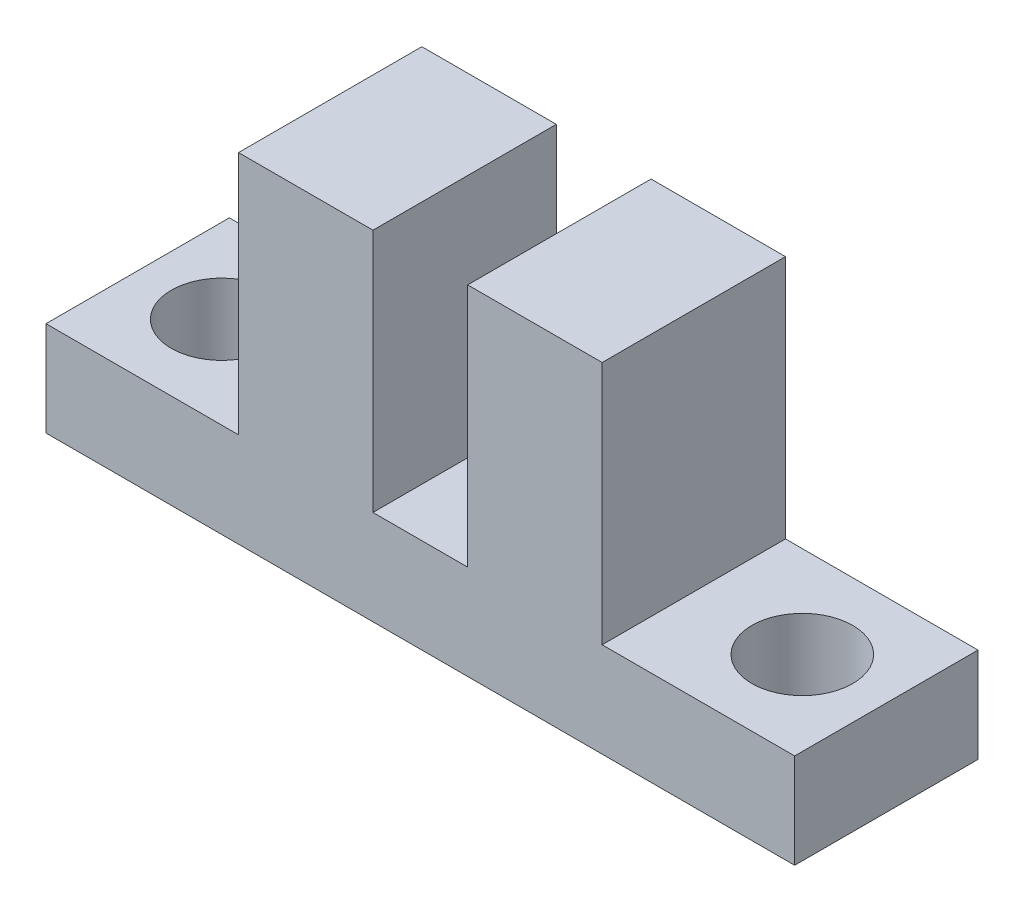
from build123d import *

# Parameters (mm, degrees)
SKETCH1_W           = 24.5
SKETCH1_H           = 6
SKETCH1_R           = 1.65
BOSS_EXTRUDE1_DEPTH = 3.1
SKETCH2_W           = 4.4
SKETCH2_H           = 6
BOSS_EXTRUDE2_DEPTH = 8


with BuildPart() as part:
    # Sketch1 → Boss-Extrude1 (new body)
    with BuildSketch(Plane(origin=(0, 0, 0), x_dir=(1, 0, 0), z_dir=(0, 1, 0))):
        with Locations((12.25, 3)):
            Rectangle(SKETCH1_W, SKETCH1_H)
        with Locations(Location((2.75, 3, 0), (0, 0, 90))):
            Circle(SKETCH1_R, mode=Mode.SUBTRACT)
        with Locations(Location((21.75, 3, 0), (0, 0, 90))):
            Circle(SKETCH1_R, mode=Mode.SUBTRACT)
    extrude(amount=BOSS_EXTRUDE1_DEPTH)

    # Sketch2 → Boss-Extrude2 (add)
    with BuildSketch(Plane(origin=(0, 3.1, 0), x_dir=(1, 0, 0), z_dir=(0, 1, 0))):
        with Locations((8.5, 3)):
            Rectangle(SKETCH2_W, SKETCH2_H)
        with Locations((16, 3)):
            Rectangle(SKETCH2_W, SKETCH2_H)
    extrude(amount=BOSS_EXTRUDE2_DEPTH)


solid = part.part
